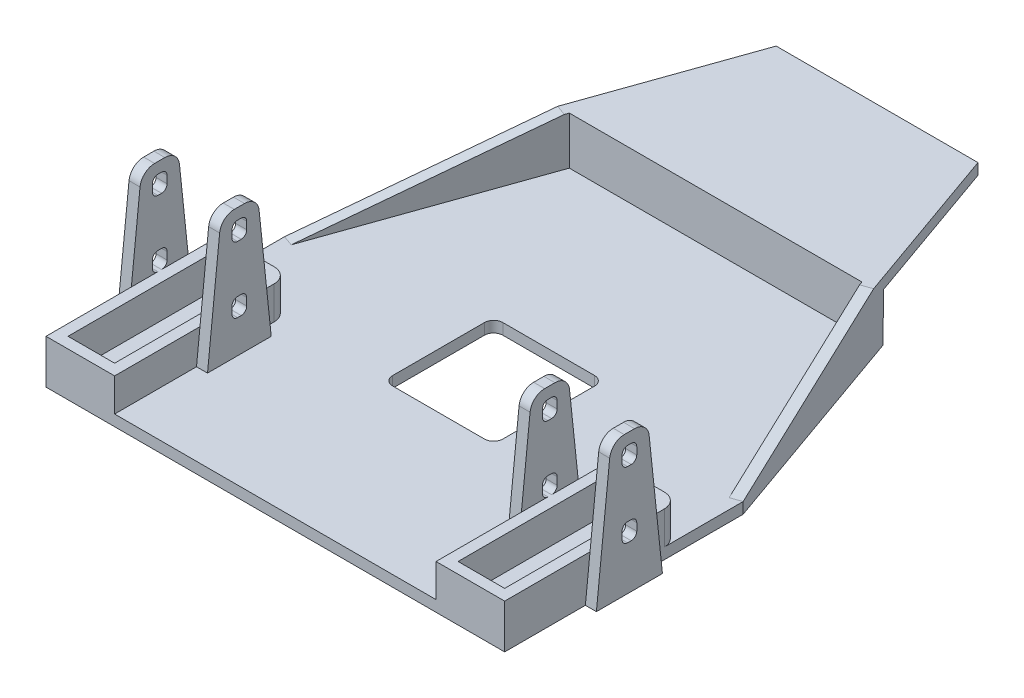
from build123d import *

# Parameters (mm, degrees)
ESBO_O1_W             = 125
ESBO_O1_H             = 124
EXTRUS_O1_DEPTH       = 3
ESBO_O2_W             = 12.7
ESBO_O2_H             = 41.5
EXTRUS_O2_DEPTH       = 9
FILETE1_R             = 4
FILETE2_R             = 2
FILETE3_R             = 4
FILETE4_R             = 2
EXTRUS_O4_START       = -3
ESBO_O3_W             = 3
ESBO_O3_H             = 10
EXTRUS_O4_DEPTH       = 38
EXTRUS_O5_DEPTH       = 150.829903557
EXTRUS_O6_DEPTH       = 150.829903557
EXTRUS_O7_DEPTH       = 3
EXTRUS_O8_DEPTH       = 3
FILETE5_R             = 4
FILETE6_R             = 4
EXTRUS_O9_DEPTH       = 3
ESBO_O10_W            = 125
ESBO_O10_H            = 4
EXTRUS_O10_DEPTH      = 13
ESBO_O11_W            = 125
ESBO_O11_H            = 3
EXTRUS_O11_DEPTH      = 40
EXTRUS_O12_DEPTH      = 40
EXTRUS_O12_DEPTH_BACK = 40
EXTRUS_O18_DEPTH      = 3
ESBO_O16_R            = 5.25
EXTRUS_O19_DEPTH      = 2


with BuildPart() as part:
    # Esboço1 → Extrusão1 (new body)
    with BuildSketch(Plane(origin=(0, 0, 0), x_dir=(1, 0, 0), z_dir=(0, 1, 0))):
        Rectangle(ESBO_O1_W, ESBO_O1_H)
    extrude(amount=EXTRUS_O1_DEPTH)

    # Esboço2 → Extrusão2 (add)
    with BuildSketch(Plane(origin=(0, 3, 0), x_dir=(1, 0, 0), z_dir=(0, 1, 0))):
        Polygon((-62.5, -26), (-62.5, -14.5), (-43.8, -14.5), (-43.8, -62), (-62.5, -62), (-62.5, -36), align=None)
        with Locations((-53.15, -38.25)):
            Rectangle(ESBO_O2_W, ESBO_O2_H, mode=Mode.SUBTRACT)
    extrus_o2 = extrude(amount=EXTRUS_O2_DEPTH)

    # Filete1
    filete1_edges = [part.edges().sort_by_distance(p)[0] for p in [
        (-62.5, 7.5, 14.5),
        (-43.8, 7.5, 14.5),
    ]]
    fillet(filete1_edges, radius=FILETE1_R)

    # Filete2
    filete2_edges = [part.edges().sort_by_distance(p)[0] for p in [
        (-46.8, 7.5, 17.5),
        (-59.5, 7.5, 17.5),
    ]]
    fillet(filete2_edges, radius=FILETE2_R)

    # Espelhar3: Extrusão2 across plane
    add(extrus_o2.mirror(Plane(origin=(0, 0, 0), x_dir=(0, 0, 1), z_dir=(1, 0, 0))))

    # Filete3
    filete3_edges = [part.edges().sort_by_distance(p)[0] for p in [
        (62.5, 7.5, 14.5),
        (43.8, 7.5, 14.5),
    ]]
    fillet(filete3_edges, radius=FILETE3_R)

    # Filete4
    filete4_edges = [part.edges().sort_by_distance(p)[0] for p in [
        (59.5, 7.5, 17.5),
        (46.8, 7.5, 17.5),
    ]]
    fillet(filete4_edges, radius=FILETE4_R)

    # Esboço3 → Extrusão4 (add)
    with BuildSketch(Plane(origin=(0, 3, 0), x_dir=(1, 0, 0), z_dir=(0, 1, 0)).offset(EXTRUS_O4_START)):
        with Locations((-64, -31)):
            Rectangle(ESBO_O3_W, ESBO_O3_H)
        with Locations((-42.3, -31)):
            Rectangle(ESBO_O3_W, ESBO_O3_H)
    extrus_o4 = extrude(amount=EXTRUS_O4_DEPTH)

    # Espelhar6: Extrusão4 across plane
    add(extrus_o4.mirror(Plane(origin=(0, 0, 0), x_dir=(0, 0, 1), z_dir=(1, 0, 0))))

    # Esboço5 → Extrusão5 (cut, through all)
    with BuildSketch(Plane.ZY.offset(65.5)):
        with BuildLine():
            Line((30.5, 12), (31.5, 12))
            ThreePointArc((31.5, 12), (32.560660172, 12.439339828), (33, 13.5))
            Line((33, 13.5), (33, 15.5))
            ThreePointArc((33, 15.5), (32.560660172, 16.560660172), (31.5, 17))
            Line((31.5, 17), (30.5, 17))
            ThreePointArc((30.5, 17), (29.439339828, 16.560660172), (29, 15.5))
            Line((29, 15.5), (29, 13.5))
            ThreePointArc((29, 13.5), (29.439339828, 12.439339828), (30.5, 12))
        make_face()
    extrude(amount=-EXTRUS_O5_DEPTH, mode=Mode.SUBTRACT)

    # Esboço6 → Extrusão6 (cut, through all)
    with BuildSketch(Plane.ZY.offset(65.5)):
        with BuildLine():
            Line((30.5, 30), (31.5, 30))
            ThreePointArc((31.5, 30), (32.560660172, 30.439339828), (33, 31.5))
            Line((33, 31.5), (33, 33.5))
            ThreePointArc((33, 33.5), (32.560660172, 34.560660172), (31.5, 35))
            Line((31.5, 35), (30.5, 35))
            ThreePointArc((30.5, 35), (29.439339828, 34.560660172), (29, 33.5))
            Line((29, 33.5), (29, 31.5))
            ThreePointArc((29, 31.5), (29.439339828, 30.439339828), (30.5, 30))
        make_face()
    extrude(amount=-EXTRUS_O6_DEPTH, mode=Mode.SUBTRACT)

    # Esboço7 → Extrusão7 (add)
    with BuildSketch(Plane.ZY.offset(65.5)):
        Polygon((26, 0), (22, 0), (26, 38), align=None)
        Polygon((36, 38), (36, 0), (40, 0), align=None)
    extrus_o7 = extrude(amount=-EXTRUS_O7_DEPTH)

    # Esboço8 → Extrusão8 (add)
    with BuildSketch(Plane.ZY.offset(43.8)):
        Polygon((26, 38), (22, 0), (26, 0), align=None)
        Polygon((36, 38), (36, 0), (40, 0), align=None)
    extrus_o8 = extrude(amount=-EXTRUS_O8_DEPTH)

    # Filete5
    filete5_edges = [part.edges().sort_by_distance(p)[0] for p in [
        (-64, 38, 26),
        (-64, 38, 36),
        (-42.3, 38, 36),
        (-42.3, 38, 26),
    ]]
    fillet(filete5_edges, radius=FILETE5_R)

    # Espelhar9: Extrusão7, Extrusão8 across plane
    add(extrus_o7.mirror(Plane(origin=(0, 0, 0), x_dir=(0, 0, 1), z_dir=(1, 0, 0))))
    add(extrus_o8.mirror(Plane(origin=(0, 0, 0), x_dir=(0, 0, 1), z_dir=(1, 0, 0))))

    # Filete6
    filete6_edges = [part.edges().sort_by_distance(p)[0] for p in [
        (64, 38, 26),
        (64, 38, 36),
        (42.3, 38, 36),
        (42.3, 38, 26),
    ]]
    fillet(filete6_edges, radius=FILETE6_R)

    # Esboço9 → Extrusão9 (cut)
    with BuildSketch(Plane(origin=(0, 3, 0), x_dir=(1, 0, 0), z_dir=(0, 1, 0))):
        with BuildLine():
            Line((-12.5, -17.5), (12.5, -17.5))
            ThreePointArc((12.5, -17.5), (14.267766953, -16.767766953), (15, -15))
            Line((15, -15), (15, 10))
            ThreePointArc((15, 10), (14.267766953, 11.767766953), (12.5, 12.5))
            Line((12.5, 12.5), (-12.5, 12.5))
            ThreePointArc((-12.5, 12.5), (-14.267766953, 11.767766953), (-15, 10))
            Line((-15, 10), (-15, -15))
            ThreePointArc((-15, -15), (-14.267766953, -16.767766953), (-12.5, -17.5))
        make_face()
    extrude(amount=-EXTRUS_O9_DEPTH, mode=Mode.SUBTRACT)

    # Esboço10 → Extrusão10 (add)
    with BuildSketch(Plane(origin=(0, 3, 0), x_dir=(1, 0, 0), z_dir=(0, 1, 0))):
        with Locations((0, 60)):
            Rectangle(ESBO_O10_W, ESBO_O10_H)
    extrude(amount=EXTRUS_O10_DEPTH)

    # Esboço11 → Extrusão11 (add)
    with BuildSketch(Plane(origin=(0, 0, -62), x_dir=(-1, 0, 0), z_dir=(0, 0, -1))):
        with Locations((0, 14.5)):
            Rectangle(ESBO_O11_W, ESBO_O11_H)
    extrude(amount=EXTRUS_O11_DEPTH)

    # Esboço13 → Extrusão12 (cut, two sides: drawn at the far end of the back side and taken through both)
    with BuildSketch(Plane(origin=(0, 3, 0), x_dir=(1, 0, 0), z_dir=(0, 1, 0)).offset(-EXTRUS_O12_DEPTH_BACK)):
        Polygon((-62.5, 3), (-27.5, 102), (-62.5, 102), align=None)
        Polygon((27.5, 102), (62.5, 102), (62.5, 3), align=None)
    extrude(amount=EXTRUS_O12_DEPTH + EXTRUS_O12_DEPTH_BACK, mode=Mode.SUBTRACT)

    # Esboço15 → Extrusão18 (add)
    with BuildSketch(Plane(origin=(56.498957011, 0, -19.974378741), x_dir=(-0.3333182172036595, 0, -0.9428143858046366), z_dir=(0.9428143858046366, 0, -0.3333182172036595))):
        Polygon((44.72381831, 16), (40.332033358, 16), (-18.003945418, 3), (-18.003945418, 0), (44.574649996, 0), align=None)
    extrus_o18 = extrude(amount=-EXTRUS_O18_DEPTH)

    # Espelhar10: Extrusão18 across plane
    add(extrus_o18.mirror(Plane(origin=(0, 0, 0), x_dir=(0, 0, 1), z_dir=(1, 0, 0))))

    # Esboço16 → Extrusão19 (cut)
    with BuildSketch(Plane.XZ):
        with Locations(Location((-12, 52, 0), (0, 0, 270))):
            Circle(ESBO_O16_R)
        with Locations(Location((12, 52, 0), (0, 0, 270))):
            Circle(ESBO_O16_R)
        with Locations(Location((-12, -47, 0), (0, 0, 270))):
            Circle(ESBO_O16_R)
        with Locations(Location((12, -47, 0), (0, 0, 270))):
            Circle(ESBO_O16_R)
    extrude(amount=-EXTRUS_O19_DEPTH, mode=Mode.SUBTRACT)


solid = part.part
